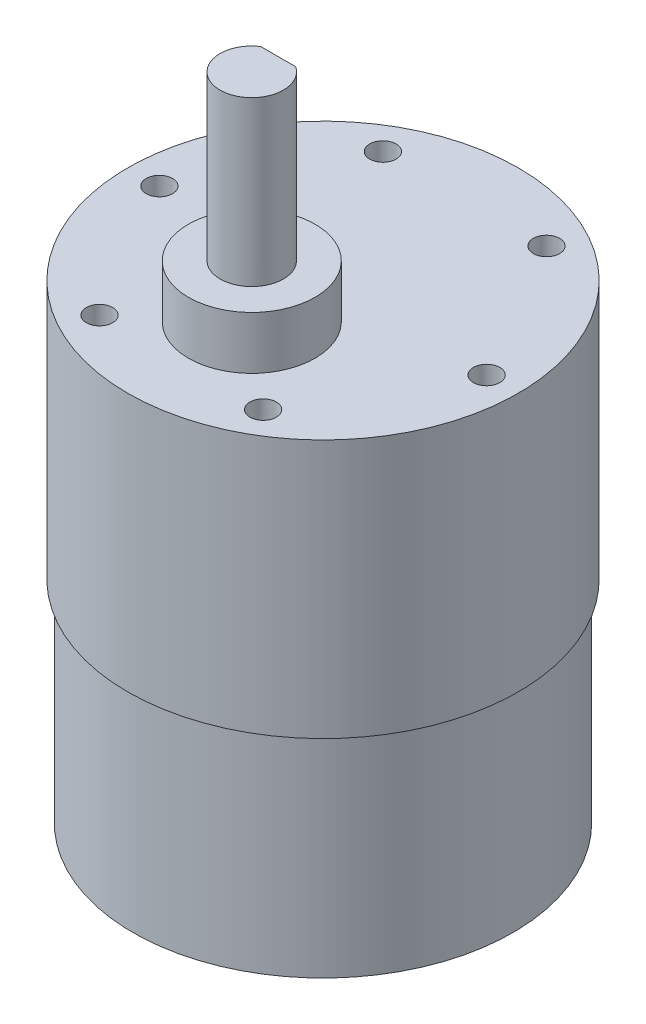
from build123d import *

# Parameters (mm, degrees)
SKETCH_1_W                  = 18.5
SKETCH_1_H                  = 24.5
SKETCH_2_R                  = 6
EXTRUDE_1_DEPTH             = 5
SKETCH_3_R                  = 3
EXTRUDE_2_DEPTH             = 15.5
CUT_EXTRUDE_START           = -14
CUT_EXTRUDE_1_DEPTH         = 14
SKETCH_5_R                  = 18
EXTRUDE_3_DEPTH             = 20
HOLE_WIZARD_2_5_2_5_1_D     = 2.5
HOLE_WIZARD_2_5_2_5_1_DEPTH = 8.5
HOLE_WIZARD_2_5_2_5_1_TIP   = 0.751075774


with BuildPart() as part:
    # 草图1 → 旋转1 (revolve)
    with BuildSketch(Plane(origin=(0, 0, 0), x_dir=(-1, 0, 0), z_dir=(0, 0, -1)), mode=Mode.PRIVATE) as revolve_1_sk:
        with Locations((-9.25, -21.746377743)):
            Rectangle(SKETCH_1_W, SKETCH_1_H)
    revolve(revolve_1_sk.sketch.rotate(Axis((0, -33.996377743, 0), (0, 1, 0)), 270), axis=Axis((0, -33.996377743, 0), (0, 1, 0)))

    # 草图2 → 凸台-拉伸1 (add)
    with BuildSketch(Plane(origin=(0, -9.496377743, 0), x_dir=(-1, 0, 0), z_dir=(0, 1, 0))):
        with Locations(Location((0, 6.75, 0), (0, 0, 90))):
            Circle(SKETCH_2_R)
    extrude(amount=EXTRUDE_1_DEPTH)

    # 草图3 → 凸台-拉伸2 (add)
    with BuildSketch(Plane(origin=(0, -4.496377743, 0), x_dir=(-1, 0, 0), z_dir=(0, 1, 0))):
        with Locations(Location((0, 6.75, 0), (0, 0, 90))):
            Circle(SKETCH_3_R)
    extrude(amount=EXTRUDE_2_DEPTH)

    # 草图4 → 切除-拉伸1 (cut)
    with BuildSketch(Plane(origin=(0, 11.003622257, 0), x_dir=(-1, 0, 0), z_dir=(0, 1, 0)).offset(CUT_EXTRUDE_START)):
        with BuildLine():
            Line((1.658312395, 4.25), (-1.658312395, 4.25))
            ThreePointArc((-1.658312395, 4.25), (0, 3.75), (1.658312395, 4.25))
        make_face()
    extrude(amount=CUT_EXTRUDE_1_DEPTH, mode=Mode.SUBTRACT)

    # 草图5 → 凸台-拉伸3 (add)
    with BuildSketch(Plane.XZ.offset(33.996377743)):
        with Locations(Location((0, 0, 0), (0, 0, 270))):
            Circle(SKETCH_5_R)
    extrude(amount=EXTRUDE_3_DEPTH)

    # Ø2.5 (2.5) 直径孔1
    with Locations(Plane(origin=(0, -9.496377743, 0), x_dir=(1, 0, 0), z_dir=(0, 1, 0))):
        with Locations((-7.75, 13.423393759), (7.75, 13.423393759), (15.5, 0), (7.75, -13.423393759), (-7.75, -13.423393759), (-15.5, 0)):
            Hole(HOLE_WIZARD_2_5_2_5_1_D / 2, depth=HOLE_WIZARD_2_5_2_5_1_DEPTH)
            with Locations((0, 0, -(HOLE_WIZARD_2_5_2_5_1_DEPTH + HOLE_WIZARD_2_5_2_5_1_TIP / 2))):  # 118° drill point
                Cone(0, HOLE_WIZARD_2_5_2_5_1_D / 2, HOLE_WIZARD_2_5_2_5_1_TIP, mode=Mode.SUBTRACT)


solid = part.part
